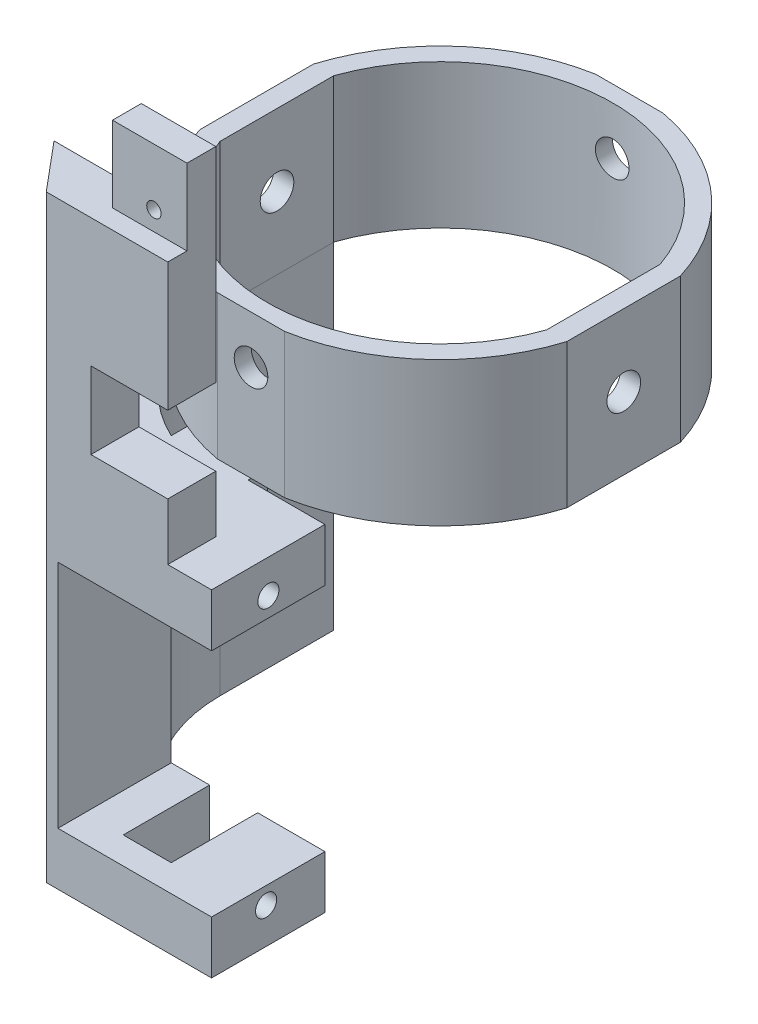
from build123d import *

# Parameters (mm, degrees)
BOSS_EXTRUDE2_DEPTH = 15
BOSS_EXTRUDE3_DEPTH = 35
BOSS_EXTRUDE4_START = -35
BOSS_EXTRUDE4_DEPTH = 35
SKETCH2_W           = 11.8
SKETCH2_H           = 24
CUT_EXTRUDE1_DEPTH  = 16
SKETCH5_W           = 2.43477795
SKETCH5_H           = 29.688989587
CUT_EXTRUDE7_DEPTH  = 8
SKETCH6_W           = 4.317840387
SKETCH6_H           = 1.457155793
CUT_EXTRUDE8_DEPTH  = 29.5
BOSS_EXTRUDE6_DEPTH = 40
SKETCH8_W           = 7.752712761
SKETCH8_H           = 12.717464329
CUT_EXTRUDE9_DEPTH  = 2
CUT_EXTRUDE10_START = -15
CUT_EXTRUDE10_DEPTH = 15
SKETCH10_W          = 5
SKETCH10_H          = 9
CUT_EXTRUDE11_DEPTH = 10
SKETCH11_W          = 9.088902154
SKETCH11_H          = 12.717464329
CUT_EXTRUDE12_DEPTH = 5
SKETCH12_R          = 1.75
CUT_EXTRUDE13_DEPTH = 40
CUT_EXTRUDE14_DEPTH = 35
SKETCH15_R          = 1.75
CUT_EXTRUDE15_DEPTH = 60
SKETCH17_R          = 1.1
CUT_EXTRUDE17_DEPTH = 6
SKETCH18_R          = 1.1
CUT_EXTRUDE18_DEPTH = 6
SKETCH20_W          = 7.752712761
SKETCH20_H          = 4.803785243
CUT_EXTRUDE19_DEPTH = 5
SKETCH19_R          = 0.75
CUT_EXTRUDE20_DEPTH = 5
SKETCH21_W          = 8
SKETCH21_H          = 8
CUT_EXTRUDE21_DEPTH = 10


with BuildPart() as part:
    # Sketch1 → Boss-Extrude2 (new body)
    with BuildSketch(Plane(origin=(0, 0, 0), x_dir=(1, 0, 0), z_dir=(0, 1, 0))):
        with BuildLine():
            ThreePointArc((-3.5, 19.691368668), (-13.235779124, 14.993803753), (-19.104973175, 5.916079783))
            Line((-19.104973175, 5.916079783), (-19.104973175, -5.916079783))
            ThreePointArc((-19.104973175, -5.916079783), (0, -20), (19.104973175, -5.916079783))
            Line((19.104973175, -5.916079783), (19.104973175, 5.916079783))
            ThreePointArc((19.104973175, 5.916079783), (13.235779124, 14.993803753), (3.5, 19.691368668))
            Line((3.5, 19.691368668), (-3.5, 19.691368668))
        make_face()
        with BuildLine():
            ThreePointArc((-17, 5.916079783), (0, 18), (17, 5.916079783))
            Line((17, 5.916079783), (17, -5.916079783))
            ThreePointArc((17, -5.916079783), (0, -18), (-17, -5.916079783))
            Line((-17, -5.916079783), (-17, 5.916079783))
        make_face(mode=Mode.SUBTRACT)
    extrude(amount=BOSS_EXTRUDE2_DEPTH)

    # Sketch9 → Cut-Extrude10 (cut)
    with BuildSketch(Plane(origin=(0, 15, 0), x_dir=(1, 0, 0), z_dir=(0, 1, 0)).offset(CUT_EXTRUDE10_START)):
        with BuildLine():
            Line((-3.5, -19.691368668), (3.5, -19.691368668))
            ThreePointArc((3.5, -19.691368668), (0, -20), (-3.5, -19.691368668))
        make_face()
    extrude(amount=CUT_EXTRUDE10_DEPTH, mode=Mode.SUBTRACT)

    # Sketch12 → Cut-Extrude13 (cut)
    with BuildSketch(Plane.ZY.offset(19.104973175)):
        with Locations((-0.016079783, 7.5)):
            Circle(SKETCH12_R)
    extrude(amount=-CUT_EXTRUDE13_DEPTH, mode=Mode.SUBTRACT)

    # Sketch15 → Cut-Extrude15 (cut)
    with BuildSketch(Plane(origin=(0, 0, -19.691368668), x_dir=(-1, 0, 0), z_dir=(0, 0, -1))):
        with Locations((0, 10)):
            Circle(SKETCH15_R)
    extrude(amount=-CUT_EXTRUDE15_DEPTH, mode=Mode.SUBTRACT)


with BuildPart() as body_2:
    # Sketch1<3> → Boss-Extrude3 (new body)
    with BuildSketch(Plane(origin=(0, 0, 0), x_dir=(1, 0, 0), z_dir=(0, 1, 0))):
        with BuildLine():
            Line((8.001725225, -20), (0, -20))
            ThreePointArc((0, -20), (-11.867569345, -16.09847191), (-19.104973175, -5.916079783))
            Line((-19.104973175, -5.916079783), (-19.104973175, -20))
            Line((-19.104973175, -20), (-9.209366103, -31.8))
            Line((-9.209366103, -31.8), (8.001725225, -31.8))
            Line((8.001725225, -31.8), (8.001725225, -20))
        make_face()
    extrude(amount=-BOSS_EXTRUDE3_DEPTH)

    # Sketch1<4> → Boss-Extrude4 (add)
    with BuildSketch(Plane(origin=(0, 0, 0), x_dir=(1, 0, 0), z_dir=(0, 1, 0)).offset(BOSS_EXTRUDE4_START)):
        with BuildLine():
            Line((-17, -5.916079783), (-17, 5.916079783))
            Line((-17, 5.916079783), (-19.104973175, 5.916079783))
            Line((-19.104973175, 5.916079783), (-19.104973175, -5.916079783))
            ThreePointArc((-19.104973175, -5.916079783), (-11.867569345, -16.09847191), (0, -20))
            Line((0, -20), (0, -18))
            ThreePointArc((0, -18), (-10.428580054, -14.671220742), (-17, -5.916079783))
        make_face()
    extrude(amount=BOSS_EXTRUDE4_DEPTH)

    # Sketch2 → Cut-Extrude1 (cut)
    with BuildSketch(Plane(origin=(8.001725225, 0, 0), x_dir=(0, 0, -1), z_dir=(1, 0, 0))):
        with Locations((-25.9, -17.5)):
            Rectangle(SKETCH2_W, SKETCH2_H)
    extrude(amount=-CUT_EXTRUDE1_DEPTH, mode=Mode.SUBTRACT)

    # Sketch5 → Cut-Extrude7 (cut)
    with BuildSketch(Plane(origin=(0, 0, 0), x_dir=(0, 0, -1), z_dir=(1, 0, 0))):
        with Locations((-18.782611025, -20.344494794)):
            Rectangle(SKETCH5_W, SKETCH5_H)
    extrude(amount=-CUT_EXTRUDE7_DEPTH, mode=Mode.SUBTRACT)

    # Sketch6 → Cut-Extrude8 (cut)
    with BuildSketch(Plane(origin=(0, -35, 0), x_dir=(-1, 0, 0), z_dir=(0, -1, 0))):
        with Locations((5.841079806, -16.836644154)):
            Rectangle(SKETCH6_W, SKETCH6_H)
    extrude(amount=-CUT_EXTRUDE8_DEPTH, mode=Mode.SUBTRACT)

    # Sketch7 → Boss-Extrude6 (add)
    with BuildSketch(Plane(origin=(0, 0, 0), x_dir=(1, 0, 0), z_dir=(0, 1, 0))):
        Polygon((-13.402419947, -26.8), (-9.209366103, -31.8), (3.439194968, -31.8), (3.439194968, -26.8), align=None)
    extrude(amount=BOSS_EXTRUDE6_DEPTH)

    # Sketch8 → Cut-Extrude9 (cut)
    with BuildSketch(Plane.XY.offset(31.8)):
        with Locations((-0.437161412, 33.641267836)):
            Rectangle(SKETCH8_W, SKETCH8_H)
    extrude(amount=-CUT_EXTRUDE9_DEPTH, mode=Mode.SUBTRACT)

    # Sketch10 → Cut-Extrude11 (cut)
    with BuildSketch(Plane(origin=(0, -29.5, 0), x_dir=(1, 0, 0), z_dir=(0, 1, 0))):
        with Locations((-1.498274775, -24.5)):
            Rectangle(SKETCH10_W, SKETCH10_H)
    extrude(amount=-CUT_EXTRUDE11_DEPTH, mode=Mode.SUBTRACT)

    # Sketch11 → Cut-Extrude12 (cut)
    with BuildSketch(Plane.XY.offset(31.8)):
        with Locations((-8.85796887, 33.641267836)):
            Rectangle(SKETCH11_W, SKETCH11_H)
    extrude(amount=-CUT_EXTRUDE12_DEPTH, mode=Mode.SUBTRACT)

    # Sketch14 → Cut-Extrude14 (cut)
    with BuildSketch(Plane.XZ.offset(35)):
        with BuildLine():
            Line((-8, 20), (-8, 16.124515497))
            ThreePointArc((-8, 16.124515497), (-13.501964299, 11.903653224), (-17, 5.916079783))
            ThreePointArc((-17, 5.916079783), (-14.557856547, 14.273065015), (-8, 20))
        make_face()
    extrude(amount=-CUT_EXTRUDE14_DEPTH, mode=Mode.SUBTRACT)

    # Sketch17 → Cut-Extrude17 (cut)
    with BuildSketch(Plane(origin=(8.001725225, 0, 0), x_dir=(0, 0, -1), z_dir=(1, 0, 0))):
        with Locations((-25.881365085, -3.483670033)):
            Circle(SKETCH17_R)
    extrude(amount=-CUT_EXTRUDE17_DEPTH, mode=Mode.SUBTRACT)

    # Sketch18 → Cut-Extrude18 (cut)
    with BuildSketch(Plane(origin=(8.001725225, 0, 0), x_dir=(0, 0, -1), z_dir=(1, 0, 0))):
        with Locations((-26.120651669, -31.282640193)):
            Circle(SKETCH18_R)
    extrude(amount=-CUT_EXTRUDE18_DEPTH, mode=Mode.SUBTRACT)

    # Sketch20 → Cut-Extrude19 (cut)
    with BuildSketch(Plane.XY.offset(29.8)):
        with Locations((-0.437161412, 37.598107379)):
            Rectangle(SKETCH20_W, SKETCH20_H)
    extrude(amount=-CUT_EXTRUDE19_DEPTH, mode=Mode.SUBTRACT)

    # Sketch19 → Cut-Extrude20 (cut)
    with BuildSketch(Plane.XY.offset(29.8)):
        with Locations((0, 29.282535671)):
            Circle(SKETCH19_R)
    extrude(amount=-CUT_EXTRUDE20_DEPTH, mode=Mode.SUBTRACT)

    # Sketch21 → Cut-Extrude21 (cut)
    with BuildSketch(Plane.XY.offset(31.8)):
        with Locations((-0.560805032, 9.918151688)):
            Rectangle(SKETCH21_W, SKETCH21_H)
    extrude(amount=-CUT_EXTRUDE21_DEPTH, mode=Mode.SUBTRACT)


solid = Compound([part.part, body_2.part])
